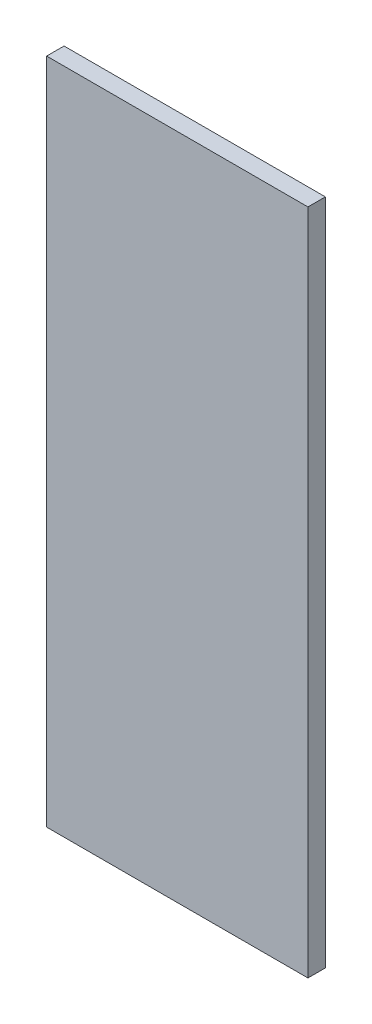
from build123d import *

# Parameters (mm, degrees)
SKETCH_1_W      = 90
SKETCH_1_H      = 230
EXTRUDE_1_DEPTH = 6


with BuildPart() as part:
    # 草图1 → 凸台-拉伸1 (new body)
    with BuildSketch(Plane.XY):
        with Locations((45, 115)):
            Rectangle(SKETCH_1_W, SKETCH_1_H)
    extrude(amount=EXTRUDE_1_DEPTH)


solid = part.part
